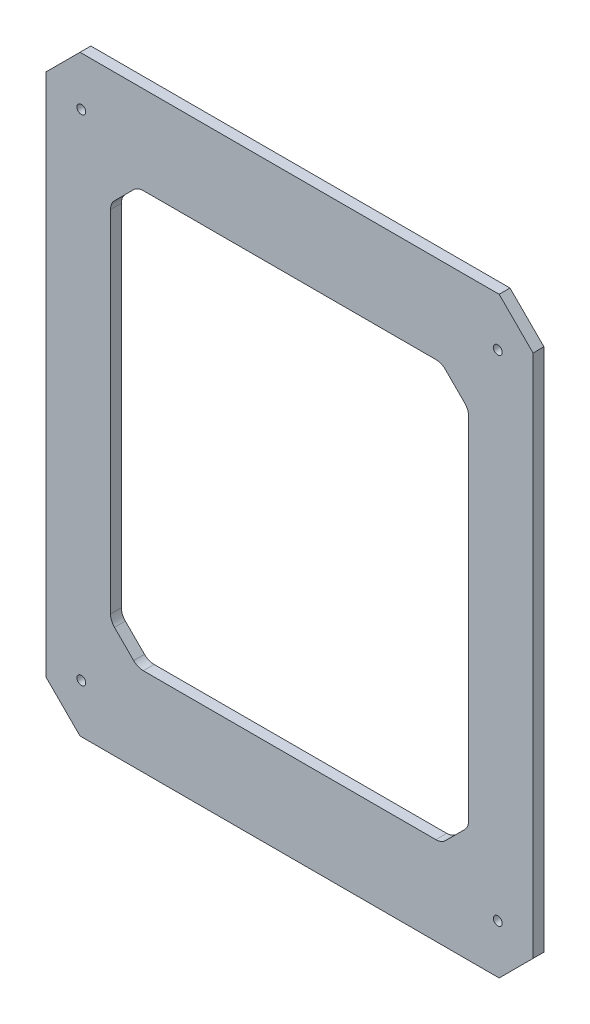
from build123d import *

# Parameters (mm, degrees)
BOSS_EXTRUDE1_DEPTH        = 8
CUT_EXTRUDE1_DEPTH         = 283.696502476
F_6_5_6_5_DIAMETER_HOLE2_D = 6.5


with BuildPart() as part:
    # Sketch1 → Boss-Extrude1 (new body)
    with BuildSketch(Plane.XY.offset(8)):
        Polygon((-154.499999959, -218.249999957), (154.500000044, -218.249999957), (179.500000086, -193.249999916), (179.500000086, 193.249999916), (154.500000044, 218.249999957), (-154.499999959, 218.249999957), (-179.5, 193.249999916), (-179.5, -193.249999916), align=None)
    extrude(amount=-BOSS_EXTRUDE1_DEPTH)

    # Sketch2 → Cut-Extrude1 (cut, through all)
    with BuildSketch(Plane(origin=(0, 0, 0), x_dir=(-1, 0, 0), z_dir=(0, 0, -1))):
        with BuildLine():
            Line((-107.857864329, -153.249999987), (107.857864423, -153.249999987))
            ThreePointArc((107.857864423, -153.249999987), (111.684698748, -152.488795312), (114.928932237, -150.321067798))
            Line((114.928932237, -150.321067798), (129.071067861, -136.178932174))
            ThreePointArc((129.071067861, -136.178932174), (131.23879537, -132.934698692), (132.000000044, -129.107864376))
            Line((132.000000044, -129.107864376), (132.000000044, 129.107864376))
            ThreePointArc((132.000000044, 129.107864376), (131.23879537, 132.934698692), (129.071067861, 136.178932174))
            Line((129.071067861, 136.178932174), (114.928932237, 150.321067798))
            ThreePointArc((114.928932237, 150.321067798), (111.684698748, 152.488795312), (107.857864423, 153.249999987))
            Line((107.857864423, 153.249999987), (-107.857864329, 153.249999987))
            ThreePointArc((-107.857864329, 153.249999987), (-111.684698653, 152.488795312), (-114.928932143, 150.321067798))
            Line((-114.928932143, 150.321067798), (-129.071067767, 136.178932174))
            ThreePointArc((-129.071067767, 136.178932174), (-131.238795276, 132.934698692), (-131.999999949, 129.107864376))
            Line((-131.999999949, 129.107864376), (-131.999999949, -129.107864376))
            ThreePointArc((-131.999999949, -129.107864376), (-131.238795276, -132.934698692), (-129.071067767, -136.178932174))
            Line((-129.071067767, -136.178932174), (-114.928932143, -150.321067798))
            ThreePointArc((-114.928932143, -150.321067798), (-111.684698653, -152.488795312), (-107.857864329, -153.249999987))
        make_face()
    extrude(amount=-CUT_EXTRUDE1_DEPTH, mode=Mode.SUBTRACT)

    # Ø6.5 (6.5) Diameter Hole2 (through all)
    with Locations(Plane(origin=(0, 0, 0), x_dir=(-1, 0, 0), z_dir=(0, 0, -1))):
        with Locations((-153.5, -182.25), (153.5, -182.25), (-153.5, 182.25), (153.5, 182.25)):
            Hole(F_6_5_6_5_DIAMETER_HOLE2_D / 2)


solid = part.part
